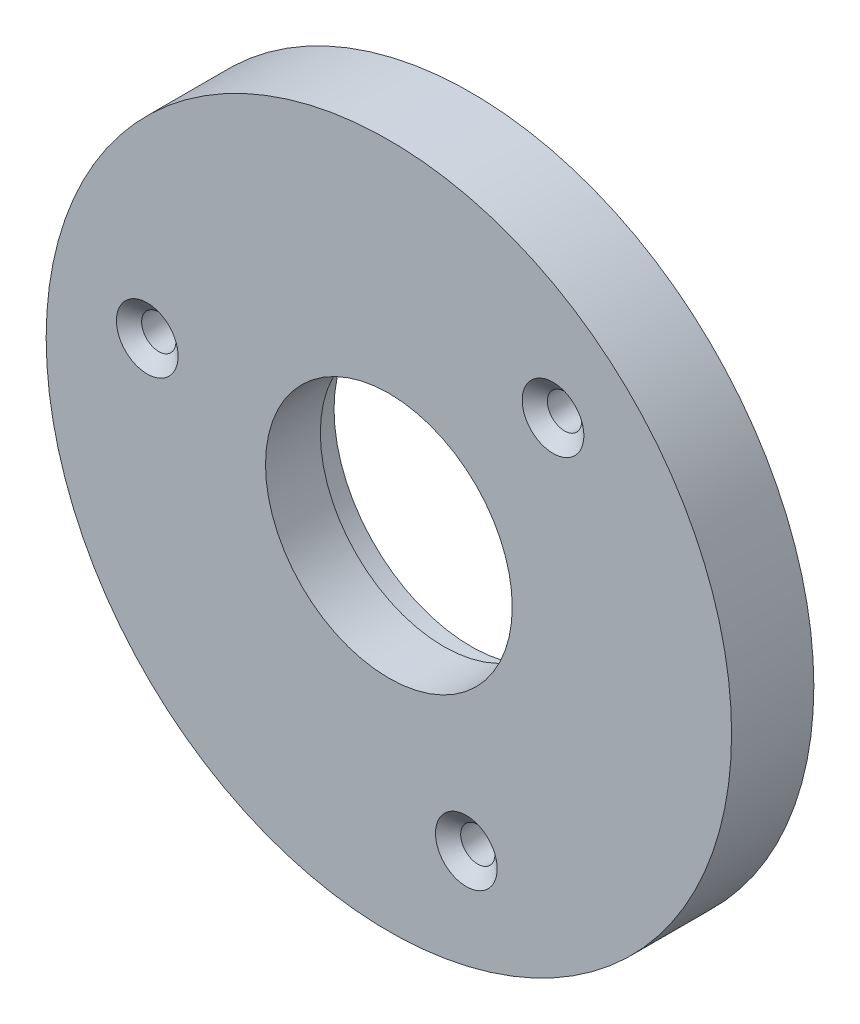
from build123d import *

# Parameters (mm, degrees)
SKETCH1_R                                = 15.875
BOSS_EXTRUDE1_DEPTH                      = 3.81
SKETCH2_R                                = 5.715
CUT_EXTRUDE1_DEPTH                       = 23.771634768
SKETCH3_R                                = 6.35
CUT_EXTRUDE3_DEPTH                       = 1.27
F_1_16_0_0625_DIAMETER_HOLE1_D           = 1.5875
F_1_16_0_0625_DIAMETER_HOLE1_CSINK_D     = 2.8575
F_1_16_0_0625_DIAMETER_HOLE1_CSINK_ANGLE = 100
CIRPATTERN1_COUNT                        = 3


with BuildPart() as part:
    # Sketch1 → Boss-Extrude1 (new body)
    with BuildSketch(Plane.XY):
        with Locations(Location((0, 0, 0), (0, 0, 180))):
            Circle(SKETCH1_R)
    extrude(amount=BOSS_EXTRUDE1_DEPTH)

    # Sketch2 → Cut-Extrude1 (cut, through all)
    with BuildSketch(Plane.XY.offset(3.81)):
        Circle(SKETCH2_R)
    extrude(amount=-CUT_EXTRUDE1_DEPTH, mode=Mode.SUBTRACT)

    # Sketch3 → Cut-Extrude3 (cut)
    with BuildSketch(Plane(origin=(0, 0, 0), x_dir=(-1, 0, 0), z_dir=(0, 0, -1))):
        Circle(SKETCH3_R)
    extrude(amount=-CUT_EXTRUDE3_DEPTH, mode=Mode.SUBTRACT)

    # 1/16 (0.0625) Diameter Hole1 (through all)
    with Locations(Plane.XY.offset(3.81)):
        with Locations((7.60482237, 8.532969982)):
            f_1_16_0_0625_diameter_hole1 = CounterSinkHole(F_1_16_0_0625_DIAMETER_HOLE1_D / 2, F_1_16_0_0625_DIAMETER_HOLE1_CSINK_D / 2, counter_sink_angle=F_1_16_0_0625_DIAMETER_HOLE1_CSINK_ANGLE)

    # CirPattern1: 1/16 (0.0625) Diameter Hole1 ×3 about axis
    cirpattern1_axis = Axis((0, 0, 0), (0, 0, 1))
    for i in range(1, CIRPATTERN1_COUNT):
        add(f_1_16_0_0625_diameter_hole1.rotate(cirpattern1_axis, i * 360 / CIRPATTERN1_COUNT), mode=Mode.SUBTRACT)


solid = part.part
